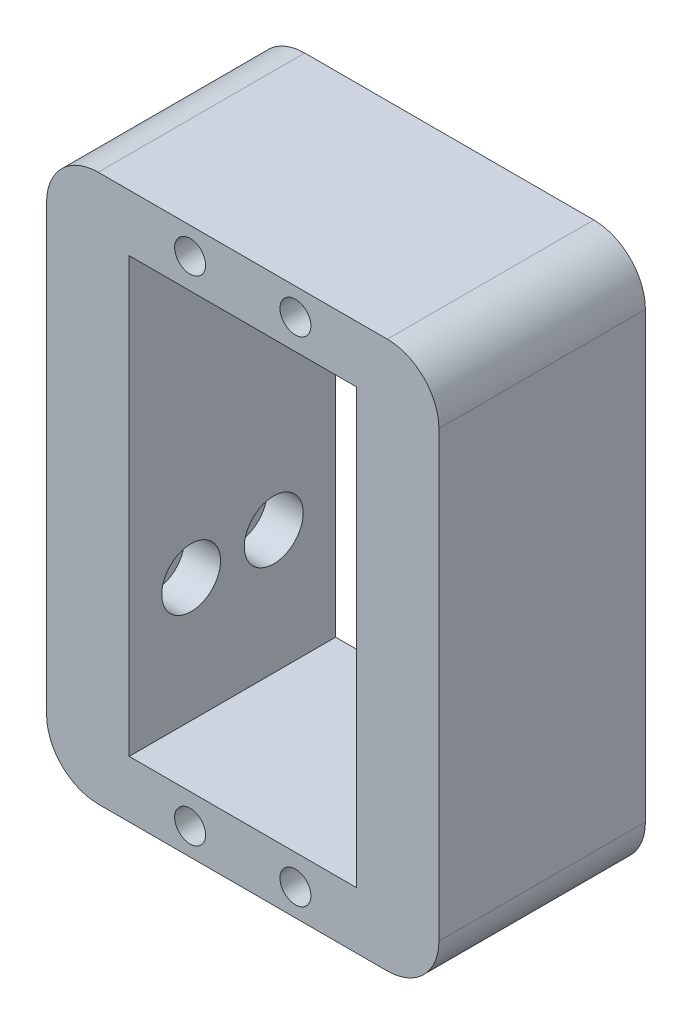
from build123d import *

# Parameters (mm, degrees)
SKETCH1_W           = 38
SKETCH1_H           = 53
SKETCH1_W_2         = 22
SKETCH1_H_2         = 42
BOSS_EXTRUDE1_DEPTH = 20
SKETCH4_R           = 1.5
CUT_EXTRUDE3_DEPTH  = 39.252450902
FILLET1_R           = 5
SKETCH5_R           = 1.75
CUT_EXTRUDE4_DEPTH  = 45.746508244
SKETCH5_3_R         = 2.85
SKETCH5_3_R_2       = 1.75
CUT_EXTRUDE5_DEPTH  = 3.5


with BuildPart() as part:
    # Sketch1 → Boss-Extrude1 (new body)
    with BuildSketch(Plane.XY):
        Rectangle(SKETCH1_W, SKETCH1_H)
        Rectangle(SKETCH1_W_2, SKETCH1_H_2, mode=Mode.SUBTRACT)
    extrude(amount=BOSS_EXTRUDE1_DEPTH)

    # Sketch4 → Cut-Extrude3 (cut, through all)
    with BuildSketch(Plane(origin=(0, 0, 0), x_dir=(-1, 0, 0), z_dir=(0, 0, -1))):
        with Locations((-5.1, -23.9)):
            Circle(SKETCH4_R)
        with Locations((5.1, -23.9)):
            Circle(SKETCH4_R)
        with Locations((-5.1, 23.9)):
            Circle(SKETCH4_R)
        with Locations((5.1, 23.9)):
            Circle(SKETCH4_R)
    extrude(amount=-CUT_EXTRUDE3_DEPTH, mode=Mode.SUBTRACT)

    # Fillet1
    fillet1_edges = [part.edges().sort_by_distance(p)[0] for p in [
        (-19, -26.5, 10),
        (19, -26.5, 10),
        (-19, 26.5, 10),
        (19, 26.5, 10),
    ]]
    fillet(fillet1_edges, radius=FILLET1_R)

    # Sketch5 → Cut-Extrude4 (cut, through all)
    with BuildSketch(Plane(origin=(-11, 0, 0), x_dir=(0, 0, -1), z_dir=(1, 0, 0))):
        with Locations((-14, -9)):
            Circle(SKETCH5_R)
        with Locations((-6, -9)):
            Circle(SKETCH5_R)
    extrude(amount=-CUT_EXTRUDE4_DEPTH, mode=Mode.SUBTRACT)

    # Sketch5<3> → Cut-Extrude5 (cut)
    # profile 1 of 2: a face of its own
    with BuildSketch(Plane(origin=(-11, 0, 0), x_dir=(0, 0, -1), z_dir=(1, 0, 0))):
        with Locations((-14, -9)):
            Circle(SKETCH5_3_R)
        with Locations((-14, -9)):
            Circle(SKETCH5_3_R_2, mode=Mode.SUBTRACT)
    # profile 2 of 2: a face of its own
    with BuildSketch(Plane(origin=(-11, 0, 0), x_dir=(0, 0, -1), z_dir=(1, 0, 0))):
        with Locations((-6, -9)):
            Circle(SKETCH5_3_R)
        with Locations((-6, -9)):
            Circle(SKETCH5_3_R_2, mode=Mode.SUBTRACT)
    extrude(amount=-CUT_EXTRUDE5_DEPTH, mode=Mode.SUBTRACT)


solid = part.part
